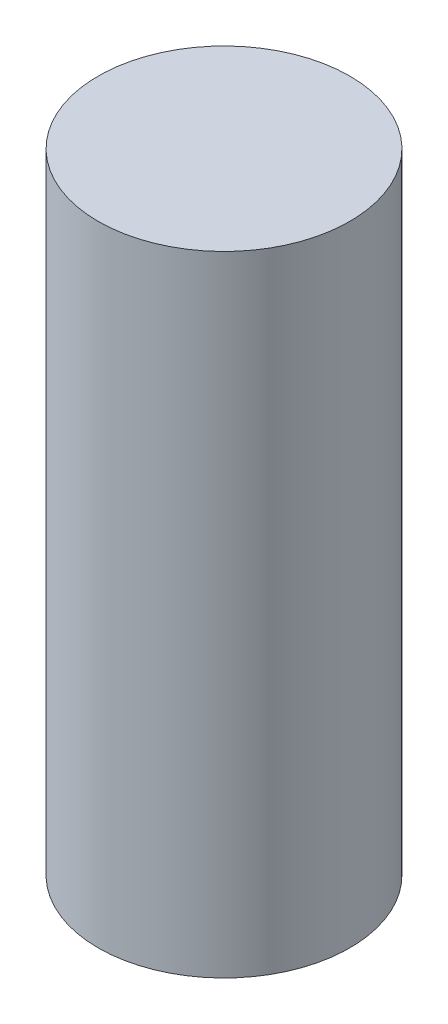
from build123d import *

# Parameters (mm, degrees)
SKETCH1_W = 38.1
SKETCH1_H = 190.5


with BuildPart() as part:
    # Sketch1 → Revolve1 (revolve)
    with BuildSketch(Plane.XY, mode=Mode.PRIVATE) as revolve1_sk:
        with Locations((-19.05, 95.25)):
            Rectangle(SKETCH1_W, SKETCH1_H)
    revolve(revolve1_sk.sketch.rotate(Axis((0, 0, 0), (0, 1, 0)), 270), axis=Axis((0, 0, 0), (0, 1, 0)))


solid = part.part
